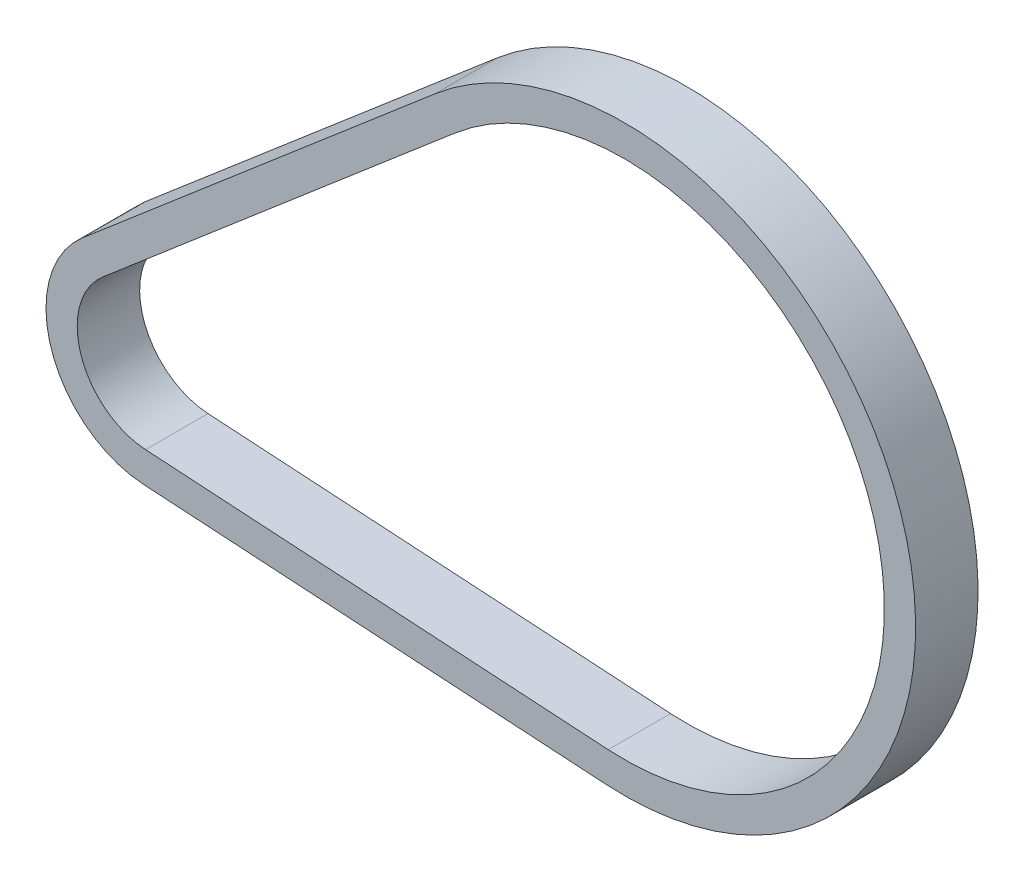
from build123d import *

# Parameters (mm, degrees)
EXTRUDE_THIN1_DEPTH      = 3.175
EXTRUDE_THIN1_DEPTH_BACK = 3.175


with BuildPart() as part:
    # Sketch1 → Extrude-Thin1 (new, two sides: drawn at the far end of the back side and taken through both)
    with BuildSketch(Plane.XY.offset(-EXTRUDE_THIN1_DEPTH_BACK)):
        with BuildLine():
            Line((-55.08318484, -8.066127227), (-19.24205779, 22.536141118))
            ThreePointArc((-19.24205779, 22.536141118), (28.104872273, 9.394178993), (-1.822937639, -29.577209855))
            Line((-1.822937639, -29.577209855), (-48.8620705, -26.678038289))
            ThreePointArc((-48.8620705, -26.678038289), (-58.248475727, -19.469812981), (-55.08318484, -8.066127227))
        make_face()
        with BuildLine():
            Line((-53.021535791, -10.480713776), (-17.180408741, 20.121554569))
            ThreePointArc((-17.180408741, 20.121554569), (25.093635958, 8.387659815), (-1.627622892, -26.408223085))
            Line((-1.627622892, -26.408223085), (-48.666755753, -23.509051519))
            ThreePointArc((-48.666755753, -23.509051519), (-55.237239412, -18.463293803), (-53.021535791, -10.480713776))
        make_face(mode=Mode.SUBTRACT)
    extrude(amount=EXTRUDE_THIN1_DEPTH + EXTRUDE_THIN1_DEPTH_BACK)


solid = part.part
